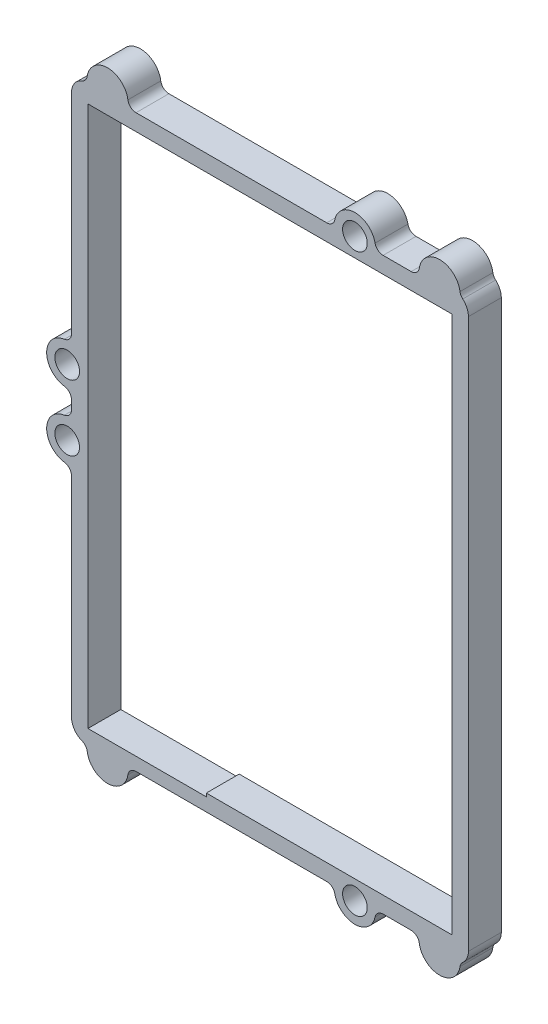
from build123d import *

# Parameters (mm, degrees)
BOSS_EXTRUDE1_DEPTH = 4
SKETCH4_R           = 1.5
CUT_EXTRUDE1_DEPTH  = 3
SKETCH5_R           = 1.5
CUT_EXTRUDE2_DEPTH  = 3
SKETCH6_W           = 14.4
SKETCH6_H           = 0.4
CUT_EXTRUDE3_DEPTH  = 4
FILLET1_R           = 1
FILLET2_R           = 2


with BuildPart() as part:
    # Sketch3 → Boss-Extrude1 (new body)
    with BuildSketch(Plane(origin=(0, 0, 0), x_dir=(0, 1, 0), z_dir=(0, 0, 1))):
        with BuildLine():
            Line((-34.7, -0.521026003), (-34.7, -2.457826354))
            ThreePointArc((-34.7, -2.457826354), (-37.7, -4.907316097), (-34.7, -7.35680584))
            Line((-34.7, -7.35680584), (-34.7, -9.880280288))
            Line((-34.7, -9.880280288), (-34.7, -32.518065271))
            ThreePointArc((-34.7, -32.518065271), (-37.5, -35), (-34.7, -37.481934729))
            Line((-34.7, -37.481934729), (-34.7, -42.857826354))
            ThreePointArc((-34.7, -42.857826354), (-37.7, -45.307316097), (-34.7, -47.75680584))
            Line((-34.7, -47.75680584), (-34.7, -48.807316097))
            Line((-34.7, -48.807316097), (34.7, -48.807316097))
            Line((34.7, -48.807316097), (34.7, -47.75680584))
            ThreePointArc((34.7, -47.75680584), (37.7, -45.307316097), (34.7, -42.857826354))
            Line((34.7, -42.857826354), (34.7, -37.481934729))
            ThreePointArc((34.7, -37.481934729), (37.5, -35), (34.7, -32.518065271))
            Line((34.7, -32.518065271), (34.7, -7.35680584))
            ThreePointArc((34.7, -7.35680584), (37.7, -4.907316097), (34.7, -2.457826354))
            Line((34.7, -2.457826354), (34.7, -0.521026003))
            Line((34.7, -0.521026003), (6.445103659, -0.521026003))
            ThreePointArc((6.445103659, -0.521026003), (4, 2.5), (1.554896341, -0.521026003))
            Line((1.554896341, -0.521026003), (-1.554896341, -0.521026003))
            ThreePointArc((-1.554896341, -0.521026003), (-4, 2.5), (-6.445103659, -0.521026003))
            Line((-6.445103659, -0.521026003), (-34.7, -0.521026003))
        make_face()
        Polygon((-32.7, -9.880280288), (-32.7, -46.807316097), (32.7, -46.807316097), (32.7, -2.521026003), (-32.7, -2.521026003), align=None, mode=Mode.SUBTRACT)
    extrude(amount=BOSS_EXTRUDE1_DEPTH)

    # Sketch4 → Cut-Extrude1 (cut)
    with BuildSketch(Plane.XY.offset(4)):
        with Locations((0, 4)):
            Circle(SKETCH4_R)
        with Locations((0, -4)):
            Circle(SKETCH4_R)
        with Locations((35, -35)):
            Circle(SKETCH4_R)
        with Locations((35, 35)):
            Circle(SKETCH4_R)
    extrude(amount=-CUT_EXTRUDE1_DEPTH, mode=Mode.SUBTRACT)

    # Sketch5 → Cut-Extrude2 (cut)
    with BuildSketch(Plane(origin=(0, 0, 0), x_dir=(1, 0, 0), z_dir=(0, 0, -1))):
        with Locations(Location((4.907316097, 35.2, 0), (0, 0, 180))):
            Circle(SKETCH5_R)
        with Locations(Location((45.307316097, 35.2, 0), (0, 0, 180))):
            Circle(SKETCH5_R)
        with Locations(Location((45.307316097, -35.2, 0), (0, 0, 180))):
            Circle(SKETCH5_R)
        with Locations(Location((4.907316097, -35.2, 0), (0, 0, 180))):
            Circle(SKETCH5_R)
    extrude(amount=-CUT_EXTRUDE2_DEPTH, mode=Mode.SUBTRACT)

    # Sketch6 → Cut-Extrude3 (cut)
    with BuildSketch(Plane.XY.offset(4)):
        with Locations((9.721026003, -32.9)):
            Rectangle(SKETCH6_W, SKETCH6_H)
    extrude(amount=-CUT_EXTRUDE3_DEPTH, mode=Mode.SUBTRACT)

    # Fillet1
    fillet1_edges = [part.edges().sort_by_distance(p)[0] for p in [
        (2.457826354, -34.7, 2),
        (0.521026003, -6.445103659, 2),
        (0.521026003, -1.554896341, 2),
        (0.521026003, 1.554896341, 2),
        (0.521026003, 6.445103659, 2),
        (2.457826354, 34.7, 2),
        (7.35680584, 34.7, 2),
        (32.518065271, 34.7, 2),
        (37.481934729, 34.7, 2),
        (42.857826354, 34.7, 2),
        (47.75680584, 34.7, 2),
        (47.75680584, -34.7, 2),
        (42.857826354, -34.7, 2),
        (37.481934729, -34.7, 2),
        (32.518065271, -34.7, 2),
        (7.35680584, -34.7, 2),
    ]]
    fillet(fillet1_edges, radius=FILLET1_R)

    # Fillet2
    fillet2_edges = [part.edges().sort_by_distance(p)[0] for p in [
        (0.521026003, 34.7, 2),
        (48.807316097, 34.7, 2),
        (48.807316097, -34.7, 2),
        (0.521026003, -34.7, 2),
    ]]
    fillet(fillet2_edges, radius=FILLET2_R)


solid = part.part
